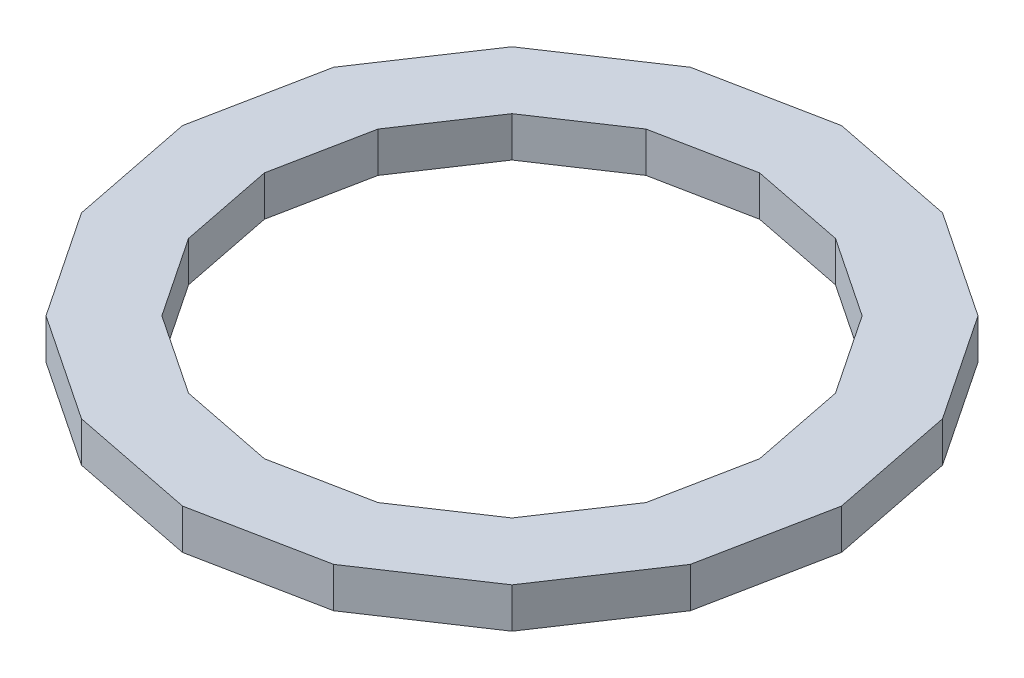
from build123d import *

# Parameters (mm, degrees)
BOSS_EXTRUDE1_DEPTH = 19.05


with BuildPart() as part:
    # Sketch1 → Boss-Extrude1 (new body)
    with BuildSketch(Plane(origin=(0, 0, 0), x_dir=(1, 0, 0), z_dir=(0, 1, 0))):
        Polygon((156.235325694, 0), (144.342619664, 59.788670693), (110.475058259, 110.475058259), (59.788670693, 144.342619664), (0, 156.235325694), (-59.788670693, 144.342619664), (-110.475058259, 110.475058259), (-144.342619664, 59.788670693), (-156.235325694, 0), (-144.342619664, -59.788670693), (-110.475058259, -110.475058259), (-59.788670693, -144.342619664), (0, -156.235325694), (59.788670693, -144.342619664), (110.475058259, -110.475058259), (144.342619664, -59.788670693), align=None)
        Polygon((117.388902567, 0), (108.453204425, 44.922788156), (83.006489041, 83.006489041), (44.922788156, 108.453204425), (0, 117.388902567), (-44.922788156, 108.453204425), (-83.006489041, 83.006489041), (-108.453204425, 44.922788156), (-117.388902567, 0), (-108.453204425, -44.922788156), (-83.006489041, -83.006489041), (-44.922788156, -108.453204425), (0, -117.388902567), (44.922788156, -108.453204425), (83.006489041, -83.006489041), (108.453204425, -44.922788156), align=None, mode=Mode.SUBTRACT)
    extrude(amount=BOSS_EXTRUDE1_DEPTH)


solid = part.part
